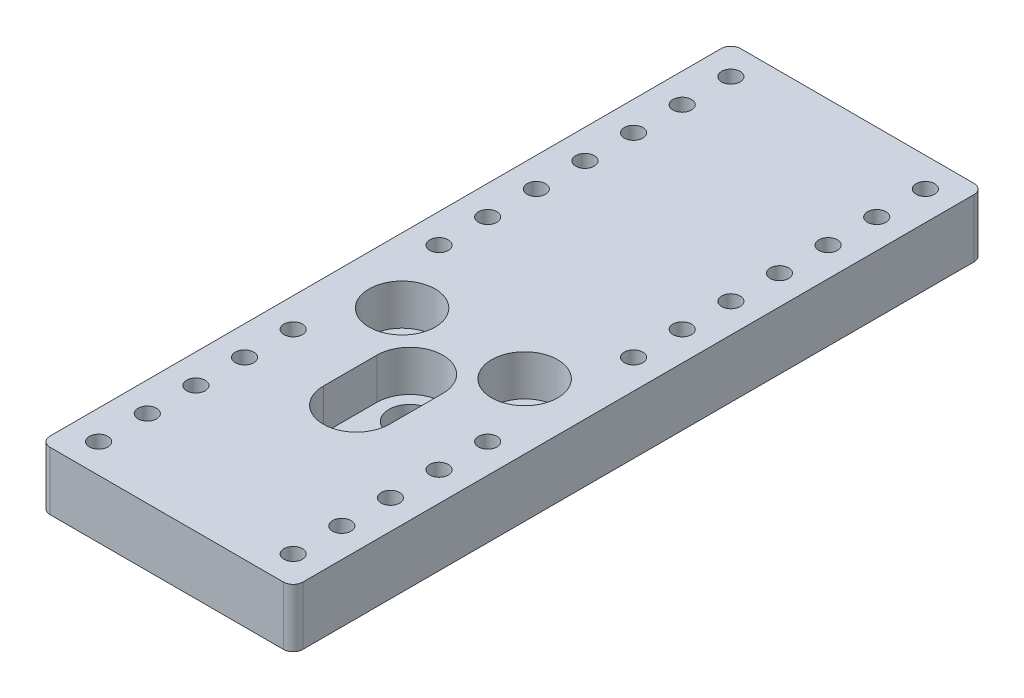
from build123d import *

# Parameters (mm, degrees)
SKETCH1_W                 = 26
SKETCH1_H                 = 71
BOSS_EXTRUDE1_DEPTH       = 6
CUT_EXTRUDE9_REACH        = 40.279
SKETCH10_R                = 2.15
SKETCH11_R                = 3.4
CUT_EXTRUDE10_DEPTH       = 4.2
SKETCH5_R                 = 0.95
CUT_EXTRUDE4_DEPTH        = 5
LPATTERN1_COUNT           = 7
LPATTERN1_PITCH           = 5
LPATTERN2_COPY_1_SKETCH_R = 0.95
LPATTERN2_COPY_1_DEPTH    = 5
LPATTERN2_COPY_2_SKETCH_R = 0.95
LPATTERN2_COPY_2_DEPTH    = 5
LPATTERN2_COPY_3_SKETCH_R = 0.95
LPATTERN2_COPY_3_DEPTH    = 5
LPATTERN2_COPY_4_SKETCH_R = 0.95
LPATTERN2_COPY_4_DEPTH    = 5
LPATTERN2_COPY_5_SKETCH_R = 0.95
LPATTERN2_COPY_5_DEPTH    = 5
LPATTERN2_COPY_6_SKETCH_R = 0.95
LPATTERN2_COPY_6_DEPTH    = 5
LPATTERN2_COPY_7_SKETCH_R = 0.95
LPATTERN2_COPY_7_DEPTH    = 5
LPATTERN2_COPY_8_SKETCH_R = 0.95
LPATTERN2_COPY_8_DEPTH    = 5
FILLET1_R                 = 1


with BuildPart() as part:
    # Sketch1 → Boss-Extrude1 (new body)
    with BuildSketch(Plane(origin=(0, 0, 0), x_dir=(1, 0, 0), z_dir=(0, 1, 0))):
        Rectangle(SKETCH1_W, SKETCH1_H)
    extrude(amount=BOSS_EXTRUDE1_DEPTH)

    # Sketch10 → Cut-Extrude9 (cut, up to next)
    with BuildSketch(Plane(origin=(0, 6, 0), x_dir=(1, 0, 0), z_dir=(0, 1, 0)), mode=Mode.PRIVATE) as cut_extrude9_sk1:
        with Locations(Location((0, -10.5, 0), (0, 0, 270))):
            Circle(SKETCH10_R)
    cut_extrude9_tool1 = extrude(cut_extrude9_sk1.sketch, amount=-CUT_EXTRUDE9_REACH, mode=Mode.PRIVATE) & part.part
    # Sketch10 → Cut-Extrude9 (cut, up to next)
    with BuildSketch(Plane(origin=(0, 6, 0), x_dir=(1, 0, 0), z_dir=(0, 1, 0)), mode=Mode.PRIVATE) as cut_extrude9_sk2:
        with Locations(Location((0, -16, 0), (0, 0, 270))):
            Circle(SKETCH10_R)
    cut_extrude9_tool2 = extrude(cut_extrude9_sk2.sketch, amount=-CUT_EXTRUDE9_REACH, mode=Mode.PRIVATE) & part.part
    # Sketch10 → Cut-Extrude9 (cut, up to next)
    with BuildSketch(Plane(origin=(0, 6, 0), x_dir=(1, 0, 0), z_dir=(0, 1, 0)), mode=Mode.PRIVATE) as cut_extrude9_sk3:
        with Locations(Location((-6.3, -5, 0), (0, 0, 270))):
            Circle(SKETCH10_R)
    cut_extrude9_tool3 = extrude(cut_extrude9_sk3.sketch, amount=-CUT_EXTRUDE9_REACH, mode=Mode.PRIVATE) & part.part
    # Sketch10 → Cut-Extrude9 (cut, up to next)
    with BuildSketch(Plane(origin=(0, 6, 0), x_dir=(1, 0, 0), z_dir=(0, 1, 0)), mode=Mode.PRIVATE) as cut_extrude9_sk4:
        with Locations(Location((6.3, -5, 0), (0, 0, 270))):
            Circle(SKETCH10_R)
    cut_extrude9_tool4 = extrude(cut_extrude9_sk4.sketch, amount=-CUT_EXTRUDE9_REACH, mode=Mode.PRIVATE) & part.part
    add(cut_extrude9_tool1.solids().sort_by_distance((0, 6, 10.5))[0], mode=Mode.SUBTRACT)
    add(cut_extrude9_tool2.solids().sort_by_distance((0, 6, 16))[0], mode=Mode.SUBTRACT)
    add(cut_extrude9_tool3.solids().sort_by_distance((-6.3, 6, 5))[0], mode=Mode.SUBTRACT)
    add(cut_extrude9_tool4.solids().sort_by_distance((6.3, 6, 5))[0], mode=Mode.SUBTRACT)

    # Sketch11 → Cut-Extrude10 (cut)
    with BuildSketch(Plane(origin=(0, 6, 0), x_dir=(1, 0, 0), z_dir=(0, 1, 0))):
        with Locations(Location((-6.3, -5, 0), (0, 0, 270))):
            Circle(SKETCH11_R)
        with Locations(Location((6.3, -5, 0), (0, 0, 270))):
            Circle(SKETCH11_R)
        with BuildLine():
            Line((3.4, -10.5), (3.4, -16))
            ThreePointArc((3.4, -16), (0, -19.4), (-3.4, -16))
            Line((-3.4, -16), (-3.4, -10.5))
            ThreePointArc((-3.4, -10.5), (0, -7.1), (3.4, -10.5))
        make_face()
    extrude(amount=-CUT_EXTRUDE10_DEPTH, mode=Mode.SUBTRACT)

    # Sketch5 → Cut-Extrude4 (cut)
    with BuildSketch(Plane(origin=(0, 6, 0), x_dir=(1, 0, 0), z_dir=(0, 1, 0))):
        with Locations(Location((-10, 32.5, 0), (0, 0, 270))):
            Circle(SKETCH5_R)
        with Locations(Location((10, 32.5, 0), (0, 0, 270))):
            Circle(SKETCH5_R)
    cut_extrude4 = extrude(amount=-CUT_EXTRUDE4_DEPTH, mode=Mode.SUBTRACT)

    # LPattern1: Cut-Extrude4 ×7
    with Locations(*[(0, 0, i * LPATTERN1_PITCH) for i in range(1, LPATTERN1_COUNT)]):
        add(cut_extrude4, mode=Mode.SUBTRACT)

    # Mirror2: Cut-Extrude4 across plane
    add(cut_extrude4.mirror(Plane.XY), mode=Mode.SUBTRACT)

    # LPattern2 copy 1 sketch → LPattern2 copy 1 (cut)
    with BuildSketch(Plane(origin=(0, 6, -5), x_dir=(1, 0, 0), z_dir=(0, 1, 0))):
        with Locations((-10, -32.5)):
            Circle(LPATTERN2_COPY_1_SKETCH_R)
        with Locations((10, -32.5)):
            Circle(LPATTERN2_COPY_1_SKETCH_R)
    extrude(amount=-LPATTERN2_COPY_1_DEPTH, mode=Mode.SUBTRACT)

    # LPattern2 copy 2 sketch → LPattern2 copy 2 (cut)
    with BuildSketch(Plane(origin=(0, 6, -10), x_dir=(1, 0, 0), z_dir=(0, 1, 0))):
        with Locations((-10, -32.5)):
            Circle(LPATTERN2_COPY_2_SKETCH_R)
        with Locations((10, -32.5)):
            Circle(LPATTERN2_COPY_2_SKETCH_R)
    extrude(amount=-LPATTERN2_COPY_2_DEPTH, mode=Mode.SUBTRACT)

    # LPattern2 copy 3 sketch → LPattern2 copy 3 (cut)
    with BuildSketch(Plane(origin=(0, 6, -15), x_dir=(1, 0, 0), z_dir=(0, 1, 0))):
        with Locations((-10, -32.5)):
            Circle(LPATTERN2_COPY_3_SKETCH_R)
        with Locations((10, -32.5)):
            Circle(LPATTERN2_COPY_3_SKETCH_R)
    extrude(amount=-LPATTERN2_COPY_3_DEPTH, mode=Mode.SUBTRACT)

    # LPattern2 copy 4 sketch → LPattern2 copy 4 (cut)
    with BuildSketch(Plane(origin=(0, 6, -20), x_dir=(1, 0, 0), z_dir=(0, 1, 0))):
        with Locations((-10, -32.5)):
            Circle(LPATTERN2_COPY_4_SKETCH_R)
        with Locations((10, -32.5)):
            Circle(LPATTERN2_COPY_4_SKETCH_R)
    extrude(amount=-LPATTERN2_COPY_4_DEPTH, mode=Mode.SUBTRACT)

    # LPattern2 copy 5 sketch → LPattern2 copy 5 (cut)
    with BuildSketch(Plane(origin=(0, 6, -5), x_dir=(1, 0, 0), z_dir=(0, 1, 0))):
        with Locations(Location((-10, 32.5, 0), (0, 0, 270))):
            Circle(LPATTERN2_COPY_5_SKETCH_R)
        with Locations(Location((10, 32.5, 0), (0, 0, 270))):
            Circle(LPATTERN2_COPY_5_SKETCH_R)
    extrude(amount=-LPATTERN2_COPY_5_DEPTH, mode=Mode.SUBTRACT)

    # LPattern2 copy 6 sketch → LPattern2 copy 6 (cut)
    with BuildSketch(Plane(origin=(0, 6, -10), x_dir=(1, 0, 0), z_dir=(0, 1, 0))):
        with Locations(Location((-10, 32.5, 0), (0, 0, 270))):
            Circle(LPATTERN2_COPY_6_SKETCH_R)
        with Locations(Location((10, 32.5, 0), (0, 0, 270))):
            Circle(LPATTERN2_COPY_6_SKETCH_R)
    extrude(amount=-LPATTERN2_COPY_6_DEPTH, mode=Mode.SUBTRACT)

    # LPattern2 copy 7 sketch → LPattern2 copy 7 (cut)
    with BuildSketch(Plane(origin=(0, 6, -15), x_dir=(1, 0, 0), z_dir=(0, 1, 0))):
        with Locations(Location((-10, 32.5, 0), (0, 0, 270))):
            Circle(LPATTERN2_COPY_7_SKETCH_R)
        with Locations(Location((10, 32.5, 0), (0, 0, 270))):
            Circle(LPATTERN2_COPY_7_SKETCH_R)
    extrude(amount=-LPATTERN2_COPY_7_DEPTH, mode=Mode.SUBTRACT)

    # LPattern2 copy 8 sketch → LPattern2 copy 8 (cut)
    with BuildSketch(Plane(origin=(0, 6, -20), x_dir=(1, 0, 0), z_dir=(0, 1, 0))):
        with Locations(Location((-10, 32.5, 0), (0, 0, 270))):
            Circle(LPATTERN2_COPY_8_SKETCH_R)
        with Locations(Location((10, 32.5, 0), (0, 0, 270))):
            Circle(LPATTERN2_COPY_8_SKETCH_R)
    extrude(amount=-LPATTERN2_COPY_8_DEPTH, mode=Mode.SUBTRACT)

    # Fillet1
    fillet1_edges = [part.edges().sort_by_distance(p)[0] for p in [
        (13, 3, 35.5),
        (-13, 3, 35.5),
        (-13, 3, -35.5),
        (13, 3, -35.5),
    ]]
    fillet(fillet1_edges, radius=FILLET1_R)


solid = part.part
